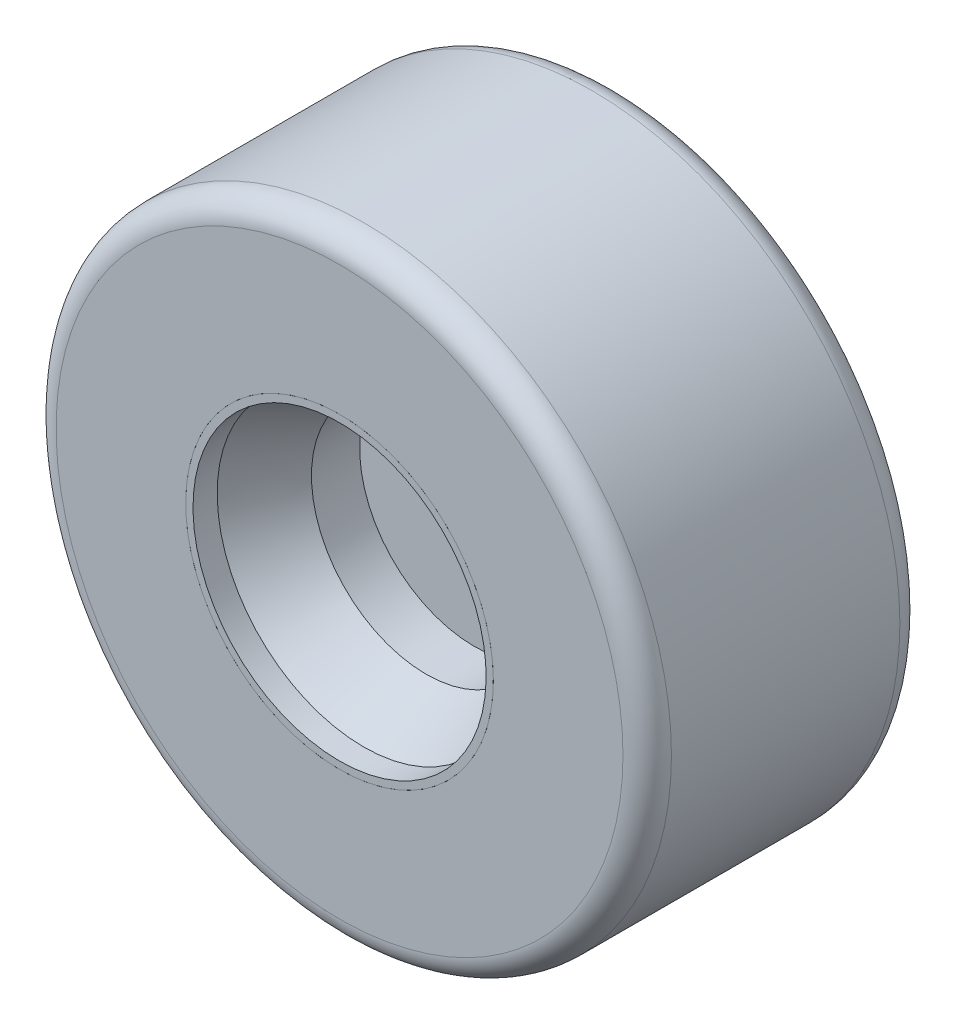
from build123d import *

# Parameters (mm, degrees)
SKETCH3_R          = 4
CUT_EXTRUDE1_DEPTH = 10


with BuildPart() as part:
    # Sketch2 → Revolve1 (revolve)
    with BuildSketch(Plane(origin=(0, 0, 0), x_dir=(0, 0, -1), z_dir=(1, 0, 0)), mode=Mode.PRIVATE) as revolve1_sk:
        Polygon((21.38, 4.617081712), (-21.38, 4.617081712), (-47.15, 17.747552546), (-57.15, 17.747552546), (-57.15, 14.747552546), (-47.15, 14.747552546), (-21.38, 1.617081712), (-1.5, 1.617081712), (-1.5, -35.752447454), (1.5, -35.752447454), (1.5, 1.617081712), (21.38, 1.617081712), (47.15, 14.747552546), (57.15, 14.747552546), (57.15, 17.747552546), (47.15, 17.747552546), align=None)
    revolve(revolve1_sk.sketch.rotate(Axis((0, -45.752447454, 57.440730664), (0, 0, -1)), 180), axis=Axis((0, -45.752447454, 57.440730664), (0, 0, -1)))

    # Sketch3 → Cut-Extrude1 (cut)
    with BuildSketch(Plane.XY.offset(1.5)):
        with Locations((20, -45.752447454)):
            Circle(SKETCH3_R)
        with Locations((0, -25.752447454)):
            Circle(SKETCH3_R)
        with Locations((-20, -45.752447454)):
            Circle(SKETCH3_R)
        with Locations((0, -65.752447454)):
            Circle(SKETCH3_R)
    extrude(amount=-CUT_EXTRUDE1_DEPTH, mode=Mode.SUBTRACT)


with BuildPart() as body_2:
    # Sketch4 → Revolve2 (revolve)
    with BuildSketch(Plane(origin=(0, 0, 0), x_dir=(0, 0, -1), z_dir=(1, 0, 0)), mode=Mode.PRIVATE) as revolve2_sk:
        with BuildLine():
            Line((-47.15, 81.247552546), (47.15, 81.247552546))
            ThreePointArc((47.15, 81.247552546), (54.221067812, 78.318620357), (57.15, 71.247552546))
            Line((57.15, 71.247552546), (57.15, 17.747552546))
            Line((57.15, 17.747552546), (47.15, 17.747552546))
            Line((47.15, 17.747552546), (21.38, 4.617081712))
            Line((21.38, 4.617081712), (-21.38, 4.617081712))
            Line((-21.38, 4.617081712), (-47.15, 17.747552546))
            Line((-47.15, 17.747552546), (-57.15, 17.747552546))
            Line((-57.15, 17.747552546), (-57.15, 71.247552546))
            ThreePointArc((-57.15, 71.247552546), (-54.221067812, 78.318620357), (-47.15, 81.247552546))
        make_face()
        with BuildLine():
            Line((-47.15, 75.102886344), (47.15, 75.102886344))
            ThreePointArc((47.15, 75.102886344), (48.917766953, 74.370653297), (49.65, 72.602886344))
            Line((49.65, 72.602886344), (49.65, 26.602886344))
            Line((49.65, 26.602886344), (45.35, 26.602886344))
            Line((45.35, 26.602886344), (19.463799916, 13.708273315))
            Line((19.463799916, 13.708273315), (-19.463799916, 13.708273315))
            Line((-19.463799916, 13.708273315), (-45.35, 26.602886344))
            Line((-45.35, 26.602886344), (-49.65, 26.602886344))
            Line((-49.65, 26.602886344), (-49.65, 72.602886344))
            ThreePointArc((-49.65, 72.602886344), (-48.917766953, 74.370653297), (-47.15, 75.102886344))
        make_face(mode=Mode.SUBTRACT)
    revolve(revolve2_sk.sketch.rotate(Axis((0, -45.752447454, 166.091754176), (0, 0, -1)), 90), axis=Axis((0, -45.752447454, 166.091754176), (0, 0, -1)))


solid = Compound([part.part, body_2.part])
